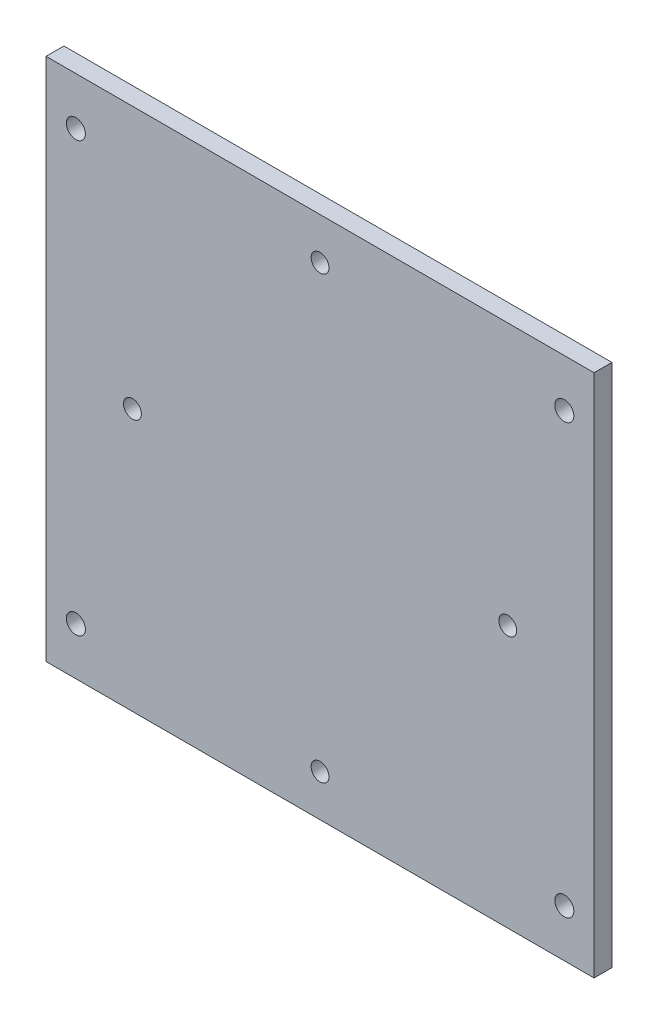
from build123d import *

# Parameters (mm, degrees)
SKETCH_1_W      = 92
SKETCH_1_H      = 88
SKETCH_1_R      = 1.6
SKETCH_1_R_2    = 1.5
EXTRUDE_1_DEPTH = 3


with BuildPart() as part:
    # 草图1 → 凸台-拉伸1 (new body)
    with BuildSketch(Plane.XY):
        with Locations((46, 44)):
            Rectangle(SKETCH_1_W, SKETCH_1_H)
        with Locations((5, 8)):
            Circle(SKETCH_1_R, mode=Mode.SUBTRACT)
        with Locations(Location((5, 80, 0), (0, 0, 180))):
            Circle(SKETCH_1_R, mode=Mode.SUBTRACT)
        with Locations(Location((87, 8, 0), (0, 0, 180))):
            Circle(SKETCH_1_R, mode=Mode.SUBTRACT)
        with Locations((87, 80)):
            Circle(SKETCH_1_R, mode=Mode.SUBTRACT)
        with Locations((46, 81)):
            Circle(SKETCH_1_R_2, mode=Mode.SUBTRACT)
        with Locations((77.5, 44)):
            Circle(SKETCH_1_R_2, mode=Mode.SUBTRACT)
        with Locations(Location((46, 7, 0), (0, 0, 180))):
            Circle(SKETCH_1_R_2, mode=Mode.SUBTRACT)
        with Locations(Location((14.5, 44, 0), (0, 0, 180))):
            Circle(SKETCH_1_R_2, mode=Mode.SUBTRACT)
    extrude(amount=EXTRUDE_1_DEPTH)


solid = part.part
